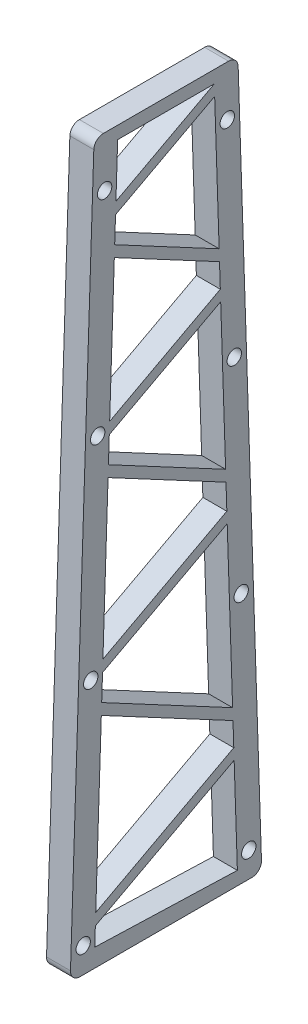
from build123d import *

# Parameters (mm, degrees)
SKETCH4_R          = 1.5
CUT_EXTRUDE2_DEPTH = 10
FILLET1_R          = 2
FILLET2_R          = 2
FILLET3_R          = 2


with BuildPart() as part:
    # Sketch3 → Loft5 section 0
    with BuildSketch(Plane(origin=(0, 150, 0), x_dir=(1, 0, 0), z_dir=(0, 1, 0))):
        with BuildLine():
            Line((0, -5), (5, -5))
            Line((5, -5), (5, -35))
            Line((5, -35), (0, -35))
            Line((0, -35), (0, -5))
        make_face()
    # Sketch1 → Loft5 section 1
    with BuildSketch(Plane(origin=(0, 0, 0), x_dir=(1, 0, 0), z_dir=(0, 1, 0))):
        with BuildLine():
            Line((0, 0), (5, 0))
            Line((5, 0), (5, -40))
            Line((5, -40), (0, -40))
            Line((0, -40), (0, 0))
        make_face()
    loft()

    # Sketch4 → Cut-Extrude2 (cut)
    with BuildSketch(Plane(origin=(5, 0, 0), x_dir=(0, 0, -1), z_dir=(1, 0, 0))):
        Polygon((-28.83317587, 10.751183083), (-34.744012882, 7.596303332), (-34.870617938, 3.798151666), (-5.096299486, 2.805674384), (-5.771452435, 23.060262851), (-10.002777007, 20.801814482), align=None)
        Polygon((-30.802515919, 43.57281452), (-33.496859429, 45.01090692), (-34.664977972, 9.967350649), (-30.802515919, 12.02892049), (-8.410719007, 23.98043032), (-5.847724207, 25.348416002), (-6.014182517, 30.342165301), (-8.410719007, 31.62130469), align=None)
        Polygon((-28.83317587, 54.994629629), (-33.242517475, 52.641165558), (-33.420587658, 47.29906007), (-28.83317587, 44.850551927), (-10.002777007, 34.799920528), (-6.093217427, 32.713212618), (-7.220454073, 66.530312006), (-9.206524468, 65.470256846), align=None)
        Polygon((-7.296725845, 68.818465156), (-7.474796028, 74.160570644), (-9.206524468, 75.084872055), (-32.087310415, 87.297377342), (-33.163482564, 55.012212875), (-30.802515919, 56.272367037), (-9.206524468, 67.799119674), align=None)
        Polygon((-31.180163293, 95.276067479), (-31.832968461, 94.927635979), (-32.011038644, 89.585530492), (-31.180163293, 89.142054921), (-9.206524468, 77.413734883), (-7.553830939, 76.531617961), (-8.580723856, 107.338405471), align=None)
        Polygon((-8.825950294, 114.695198629), (-8.656995627, 109.626558622), (-31.75393355, 97.298683296), (-30.783393843, 126.41487452), align=None)
        Polygon((-30.529051888, 134.045133158), (-30.707122071, 128.703027671), (-8.904985205, 117.066245946), (-9.839054211, 145.088316141), align=None)
        Polygon((-30.084674017, 147.376469292), (-9.915325983, 147.376469292), (-30.450016978, 136.416180475), align=None)
        with Locations(Location((-35.704151779, 52.446551388, 0), (0, 0, 180))):
            Circle(SKETCH4_R)
        with Locations((-37.276326305, 5.281315626)):
            Circle(SKETCH4_R)
        with Locations(Location((-2.723673695, 5.281315626, 0), (0, 0, 180))):
            Circle(SKETCH4_R)
        with Locations((-4.295848221, 52.446551388)):
            Circle(SKETCH4_R)
        with Locations((-5.744390435, 95.90281781)):
            Circle(SKETCH4_R)
        with Locations(Location((-34.255609565, 95.90281781, 0), (0, 0, 180))):
            Circle(SKETCH4_R)
        with Locations((-7.199004735, 139.54124683)):
            Circle(SKETCH4_R)
        with Locations(Location((-32.800995265, 139.54124683, 0), (0, 0, 180))):
            Circle(SKETCH4_R)
    extrude(amount=-CUT_EXTRUDE2_DEPTH, mode=Mode.SUBTRACT)

    # Fillet1
    fillet1_edges = [part.edges().sort_by_distance(p)[0] for p in [
        (2.5, 150, 5),
    ]]
    fillet(fillet1_edges, radius=FILLET1_R)

    # Fillet2
    fillet2_edges = [part.edges().sort_by_distance(p)[0] for p in [
        (2.5, 150, 35),
    ]]
    fillet(fillet2_edges, radius=FILLET2_R)

    # Fillet3
    fillet3_edges = [part.edges().sort_by_distance(p)[0] for p in [
        (2.5, 0, 40),
        (2.5, 0, 0),
    ]]
    fillet(fillet3_edges, radius=FILLET3_R)


solid = part.part
